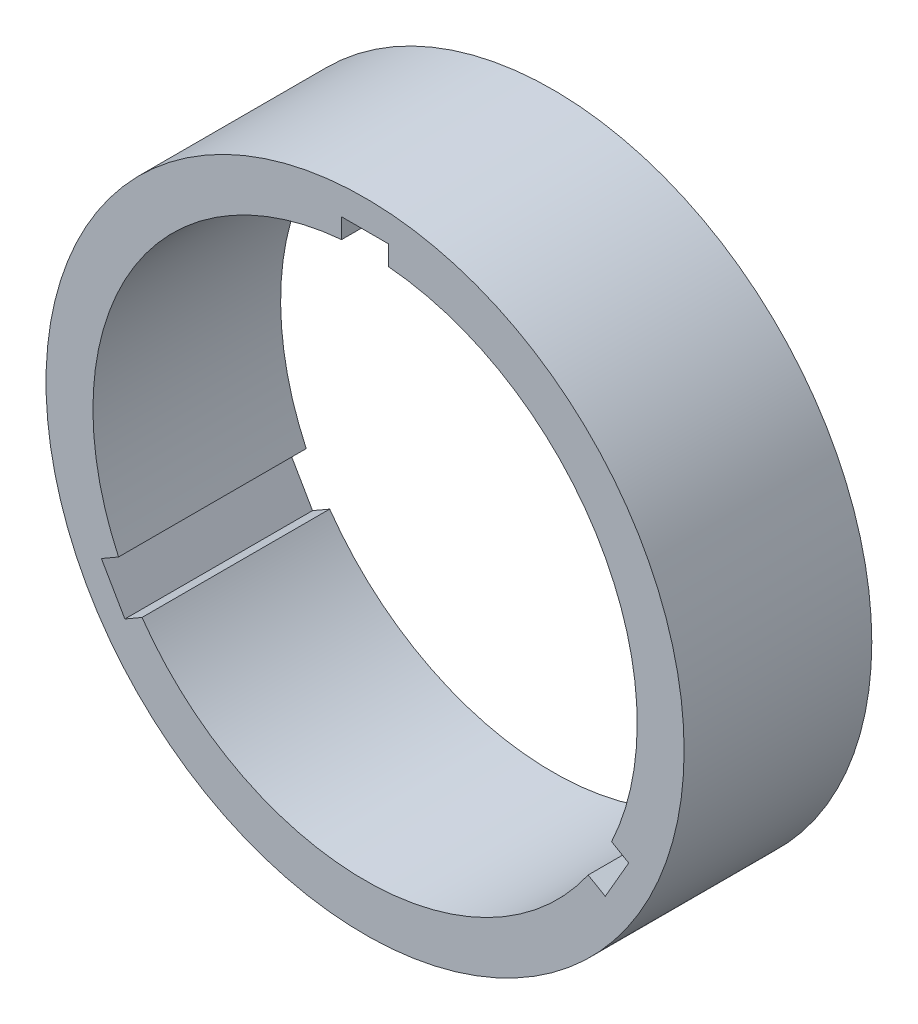
from build123d import *

# Parameters (mm, degrees)
SALIENTE_EXTRUIR1_DEPTH = 20


with BuildPart() as part:
    # Croquis1 → Saliente-Extruir1 (new body)
    with BuildSketch(Plane.XY):
        with BuildLine():
            ThreePointArc((34, 0), (24.04163056, 24.04163056), (0, 34))
            ThreePointArc((0, 34), (-24.04163056, -24.04163056), (34, 0))
        make_face()
        with BuildLine():
            Line((-2.5, 31), (0, 31))
            Line((0, 31), (2.5, 31))
            Line((2.5, 31), (2.5, 28.892040426))
            ThreePointArc((2.5, 28.892040426), (21.371710273, 19.602295784), (29, 0))
            ThreePointArc((29, 0), (28.309591911, -6.290230985), (26.271240976, -12.280956704))
            Line((26.271240976, -12.280956704), (28.096787517, -13.334936491))
            Line((28.096787517, -13.334936491), (25.596787517, -17.665063509))
            Line((25.596787517, -17.665063509), (23.771240976, -16.611083723))
            ThreePointArc((23.771240976, -16.611083723), (0, -29), (-23.771240976, -16.611083723))
            Line((-23.771240976, -16.611083723), (-25.596787517, -17.665063509))
            Line((-25.596787517, -17.665063509), (-28.096787517, -13.334936491))
            Line((-28.096787517, -13.334936491), (-26.271240976, -12.280956704))
            ThreePointArc((-26.271240976, -12.280956704), (-25.11473671, 14.5), (-2.5, 28.892040426))
            Line((-2.5, 28.892040426), (-2.5, 31))
        make_face(mode=Mode.SUBTRACT)
    extrude(amount=SALIENTE_EXTRUIR1_DEPTH)


solid = part.part
